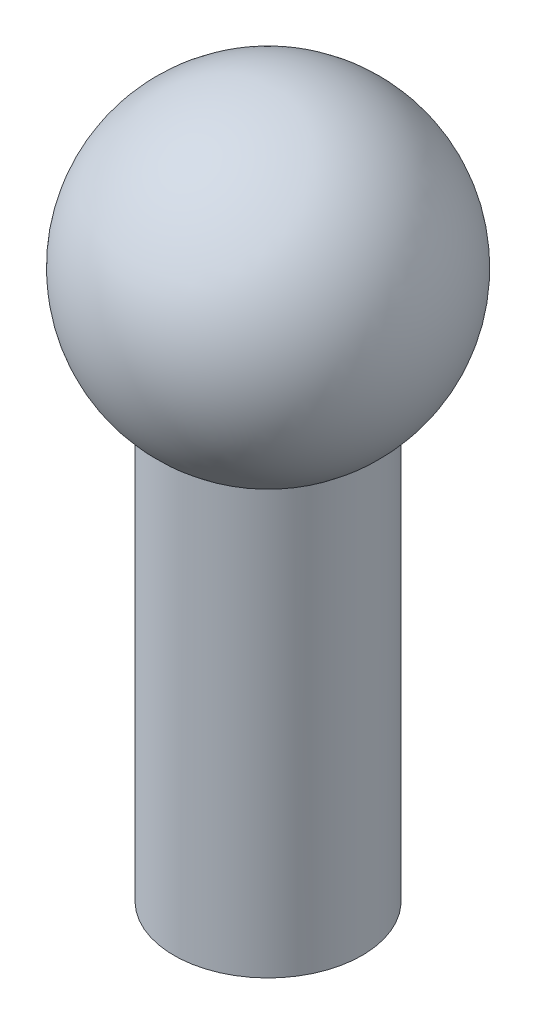
from build123d import *

# Parameters (mm, degrees)
SKETCH2_R          = 10
SKETCH2_R_2        = 5
CUT_EXTRUDE1_DEPTH = 30


with BuildPart() as part:
    # Sketch1 → Revolve1 (revolve)
    with BuildSketch(Plane.XY, mode=Mode.PRIVATE) as revolve1_sk:
        with BuildLine():
            Line((0, 0), (-12, 0))
            Line((-12, 0), (-12, 54))
            ThreePointArc((-12, 54), (-18.973665961, 76.32455532), (0, 90))
            Line((0, 90), (0, 0))
        make_face()
    revolve(revolve1_sk.sketch.rotate(Axis((0, 0, 0), (0, 1, 0)), 180), axis=Axis((0, 0, 0), (0, 1, 0)))

    # Sketch2 → Cut-Extrude1 (cut)
    with BuildSketch(Plane(origin=(0, 0, 0), x_dir=(-1, 0, 0), z_dir=(0, -1, 0))):
        with Locations(Location((0, 0, 0), (0, 0, 90))):
            Circle(SKETCH2_R)
        with Locations((0, -22)):
            Circle(SKETCH2_R_2)
        with Locations((0, 22)):
            Circle(SKETCH2_R_2)
    extrude(amount=-CUT_EXTRUDE1_DEPTH, mode=Mode.SUBTRACT)


solid = part.part
